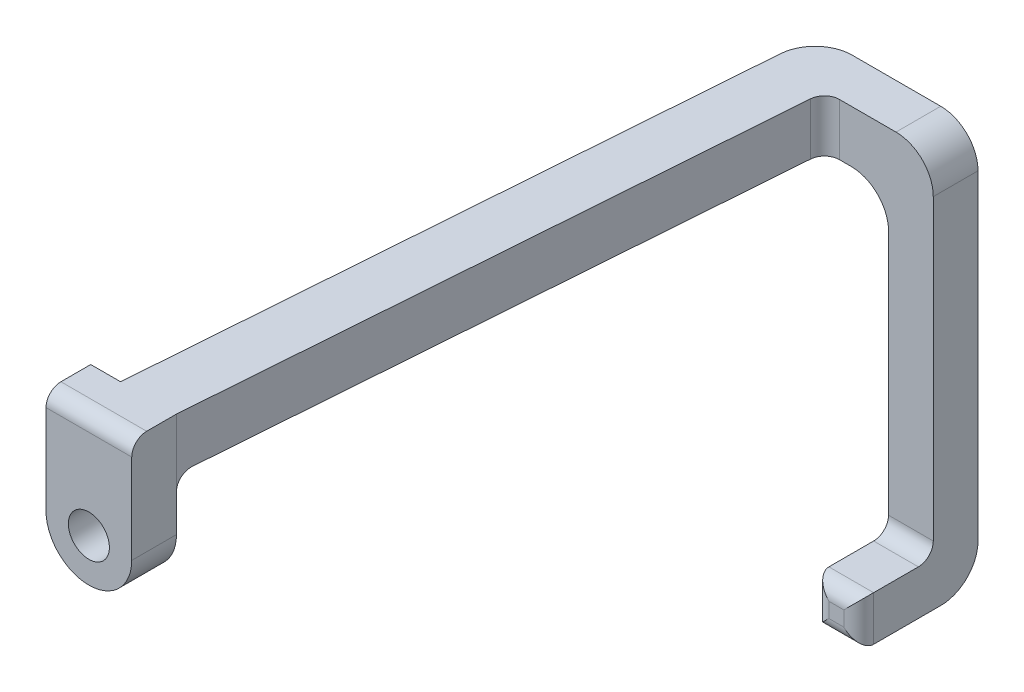
from build123d import *

# Parameters (mm, degrees)
SKETCH1_R           = 1.375
BOSS_EXTRUDE1_DEPTH = 3
BOSS_EXTRUDE2_START = 5.900862
SKETCH9_W           = 3.5
SKETCH9_H           = 3
BOSS_EXTRUDE2_DEPTH = 7.224138
BOSS_EXTRUDE3_START = -26.5
SKETCH10_W          = 3
SKETCH10_H          = 3
BOSS_EXTRUDE3_DEPTH = 23
SKETCH11_W          = 3
SKETCH11_H          = 3
BOSS_EXTRUDE4_DEPTH = 5
FILLET1_R           = 2.5
FILLET2_R           = 1


with BuildPart() as part:
    # Sketch1 → Boss-Extrude1 (new body)
    with BuildSketch(Plane(origin=(0, 0, 0), x_dir=(0, 1, 0), z_dir=(0, 0, 1))):
        with BuildLine():
            Line((0, 2.875), (7, 2.875))
            Line((7, 2.875), (7, -2.875))
            Line((7, -2.875), (0, -2.875))
            ThreePointArc((0, -2.875), (-2.875, 0), (0, 2.875))
        make_face()
        with Locations(Location((0, 0, 0), (0, 0, 270))):
            Circle(SKETCH1_R, mode=Mode.SUBTRACT)
    extrude(amount=BOSS_EXTRUDE1_DEPTH)

    # Sketch2 → Loft1 section 0
    with BuildSketch(Plane(origin=(0, 0, 0), x_dir=(1, 0, 0), z_dir=(0, 0, -1))):
        with BuildLine():
            Line((2.875, -7), (-0.875, -7))
            Line((-0.875, -7), (-0.875, -3.5))
            Line((-0.875, -3.5), (2.875, -3.5))
            Line((2.875, -3.5), (2.875, -7))
        make_face()
    # Sketch8 → Loft1 section 1
    with BuildSketch(Plane(origin=(0, 0, -43.5), x_dir=(-1, 0, 0), z_dir=(0, 0, -1))):
        with BuildLine():
            Line((-6.125, 3.5), (-6.125, 7))
            Line((-6.125, 7), (-2.375, 7))
            Line((-2.375, 7), (-2.375, 3.5))
            Line((-2.375, 3.5), (-6.125, 3.5))
        make_face()
    loft()

    # Sketch9 → Boss-Extrude2 (add)
    with BuildSketch(Plane.YZ.offset(BOSS_EXTRUDE2_START)):
        with Locations((5.25, -42)):
            Rectangle(SKETCH9_W, SKETCH9_H)
    extrude(amount=BOSS_EXTRUDE2_DEPTH)

    # Sketch10 → Boss-Extrude3 (add)
    with BuildSketch(Plane(origin=(0, 7, 0), x_dir=(-1, 0, 0), z_dir=(0, 1, 0)).offset(BOSS_EXTRUDE3_START)):
        with Locations((-11.625, -42)):
            Rectangle(SKETCH10_W, SKETCH10_H)
    extrude(amount=BOSS_EXTRUDE3_DEPTH)

    # Sketch11 → Boss-Extrude4 (add)
    with BuildSketch(Plane.XY.offset(-40.5)):
        with Locations((11.625, -18)):
            Rectangle(SKETCH11_W, SKETCH11_H)
    extrude(amount=BOSS_EXTRUDE4_DEPTH)

    # Fillet1
    fillet1_edges = [part.edges().sort_by_distance(p)[0] for p in [
        (2.375, 5.25, -43.5),
        (13.125, 7, -42),
        (11.625, -19.5, -43.5),
        (10.125, 3.5, -42),
    ]]
    fillet(fillet1_edges, radius=FILLET1_R)

    # Fillet2
    fillet2_edges = [part.edges().sort_by_distance(p)[0] for p in [
        (0, 7, 3),
        (1, 3.5, 0),
        (5.900862, 5.25, -40.5),
        (11.625, -16.5, -40.5),
        (11.625, -19.5, -35.5),
        (13.125, -18, -35.5),
        (11.625, -16.5, -35.5),
        (10.125, -18, -35.5),
    ]]
    fillet(fillet2_edges, radius=FILLET2_R)


solid = part.part
